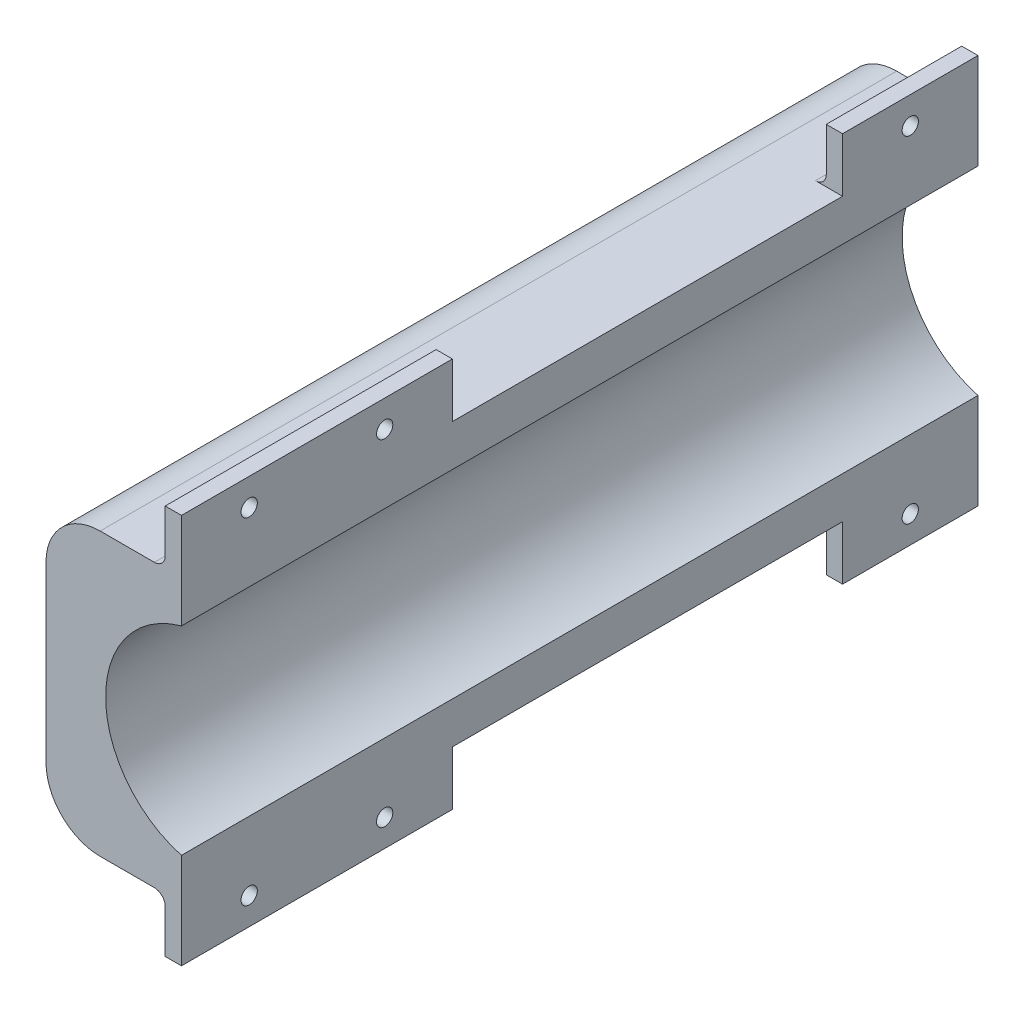
from build123d import *

# Parameters (mm, degrees)
BOSS_EXTRUDE1_DEPTH = 147
SKETCH2_W           = 50
SKETCH2_H           = 10
SKETCH2_R           = 1.5
SKETCH2_W_2         = 25
BOSS_EXTRUDE2_DEPTH = 3
FILLET1_R           = 10
FILLET2_R           = 2


with BuildPart() as part:
    # Sketch1 → Boss-Extrude1 (new body)
    with BuildSketch(Plane.XY):
        with BuildLine():
            Line((-91.459491941, 15.958690151), (-116.459491941, 15.958690151))
            Line((-116.459491941, 15.958690151), (-116.459491941, -36.041309849))
            Line((-116.459491941, -36.041309849), (-91.459491941, -36.041309849))
            Line((-91.459491941, -36.041309849), (-91.459491941, -28.371612629))
            ThreePointArc((-91.459491941, -28.371612629), (-105.459491941, -10.041309849), (-91.459491941, 8.288992931))
            Line((-91.459491941, 8.288992931), (-91.459491941, 15.958690151))
        make_face()
    extrude(amount=-BOSS_EXTRUDE1_DEPTH)

    # Sketch2 → Boss-Extrude2 (add)
    # profile 1 of 4: a face of its own
    with BuildSketch(Plane(origin=(-91.459491941, 0, 0), x_dir=(0, 0, -1), z_dir=(1, 0, 0))):
        with Locations((25, 20.958690151)):
            Rectangle(SKETCH2_W, SKETCH2_H)
        with Locations((12.5, 20.958690151)):
            Circle(SKETCH2_R, mode=Mode.SUBTRACT)
        with Locations(Location((37.5, 20.958690151, 0), (0, 0, 180))):
            Circle(SKETCH2_R, mode=Mode.SUBTRACT)
    # profile 2 of 4: a face of its own
    with BuildSketch(Plane(origin=(-91.459491941, 0, 0), x_dir=(0, 0, -1), z_dir=(1, 0, 0))):
        with Locations((134.5, 20.958690151)):
            Rectangle(SKETCH2_W_2, SKETCH2_H)
        with Locations((134.5, 20.958690151)):
            Circle(SKETCH2_R, mode=Mode.SUBTRACT)
    # profile 3 of 4: a face of its own
    with BuildSketch(Plane(origin=(-91.459491941, 0, 0), x_dir=(0, 0, -1), z_dir=(1, 0, 0))):
        with Locations((25, -41.041309849)):
            Rectangle(SKETCH2_W, SKETCH2_H)
        with Locations((37.5, -41.041309849)):
            Circle(SKETCH2_R, mode=Mode.SUBTRACT)
        with Locations(Location((12.5, -41.041309849, 0), (0, 0, 180))):
            Circle(SKETCH2_R, mode=Mode.SUBTRACT)
    # profile 4 of 4: a face of its own
    with BuildSketch(Plane(origin=(-91.459491941, 0, 0), x_dir=(0, 0, -1), z_dir=(1, 0, 0))):
        with Locations((134.5, -41.041309849)):
            Rectangle(SKETCH2_W_2, SKETCH2_H)
        with Locations(Location((134.5, -41.041309849, 0), (0, 0, 180))):
            Circle(SKETCH2_R, mode=Mode.SUBTRACT)
    extrude(amount=-BOSS_EXTRUDE2_DEPTH)

    # Fillet1
    fillet1_edges = [part.edges().sort_by_distance(p)[0] for p in [
        (-116.459491941, 15.958690151, -73.5),
        (-116.459491941, -36.041309849, -73.5),
    ]]
    fillet(fillet1_edges, radius=FILLET1_R)

    # Fillet2
    fillet2_edges = [part.edges().sort_by_distance(p)[0] for p in [
        (-94.459491941, 15.958690151, -25),
        (-94.459491941, 15.958690151, -134.5),
        (-94.459491941, -36.041309849, -25),
        (-94.459491941, -36.041309849, -134.5),
    ]]
    fillet(fillet2_edges, radius=FILLET2_R)


solid = part.part
